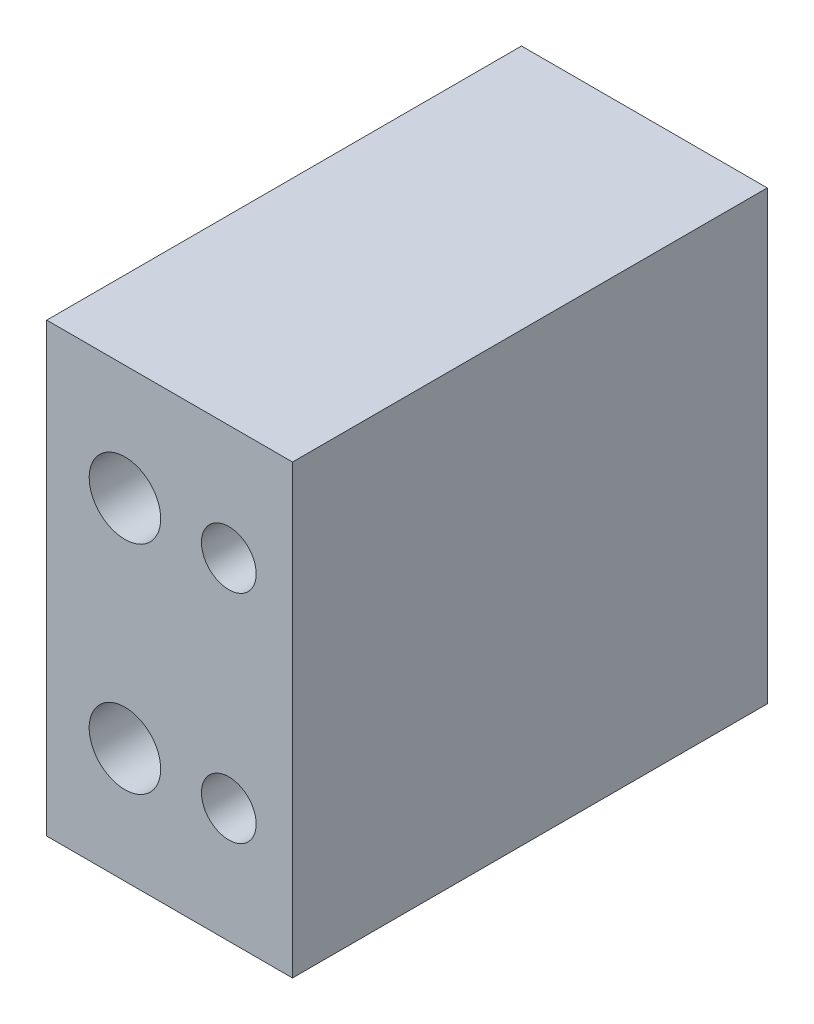
from build123d import *

# Parameters (mm, degrees)
SKETCH_3_W          = 11
SKETCH_3_H          = 20
SKETCH_3_R          = 1.6
SKETCH_3_R_2        = 1.225
EXTRUDE_1_DEPTH     = 21.25
SKETCH_4_W          = 3
SKETCH_4_H          = 5.7
CUT_EXTRUDE_1_DEPTH = 7.1


with BuildPart() as part:
    # 草图3 → 凸台-拉伸1 (new body)
    with BuildSketch(Plane.XY):
        with Locations((5.5, 10)):
            Rectangle(SKETCH_3_W, SKETCH_3_H)
        with Locations((3.5, 14.85)):
            Circle(SKETCH_3_R, mode=Mode.SUBTRACT)
        with Locations((3.5, 5.15)):
            Circle(SKETCH_3_R, mode=Mode.SUBTRACT)
        with Locations((8.15, 14.85)):
            Circle(SKETCH_3_R_2, mode=Mode.SUBTRACT)
        with Locations((8.15, 5.15)):
            Circle(SKETCH_3_R_2, mode=Mode.SUBTRACT)
    extrude(amount=EXTRUDE_1_DEPTH)

    # 草图4 → 切除-拉伸1 (cut)
    with BuildSketch(Plane.ZY):
        with Locations((4.5, 14.85)):
            Rectangle(SKETCH_4_W, SKETCH_4_H)
        with Locations((4.5, 5.15)):
            Rectangle(SKETCH_4_W, SKETCH_4_H)
    extrude(amount=-CUT_EXTRUDE_1_DEPTH, mode=Mode.SUBTRACT)


solid = part.part
